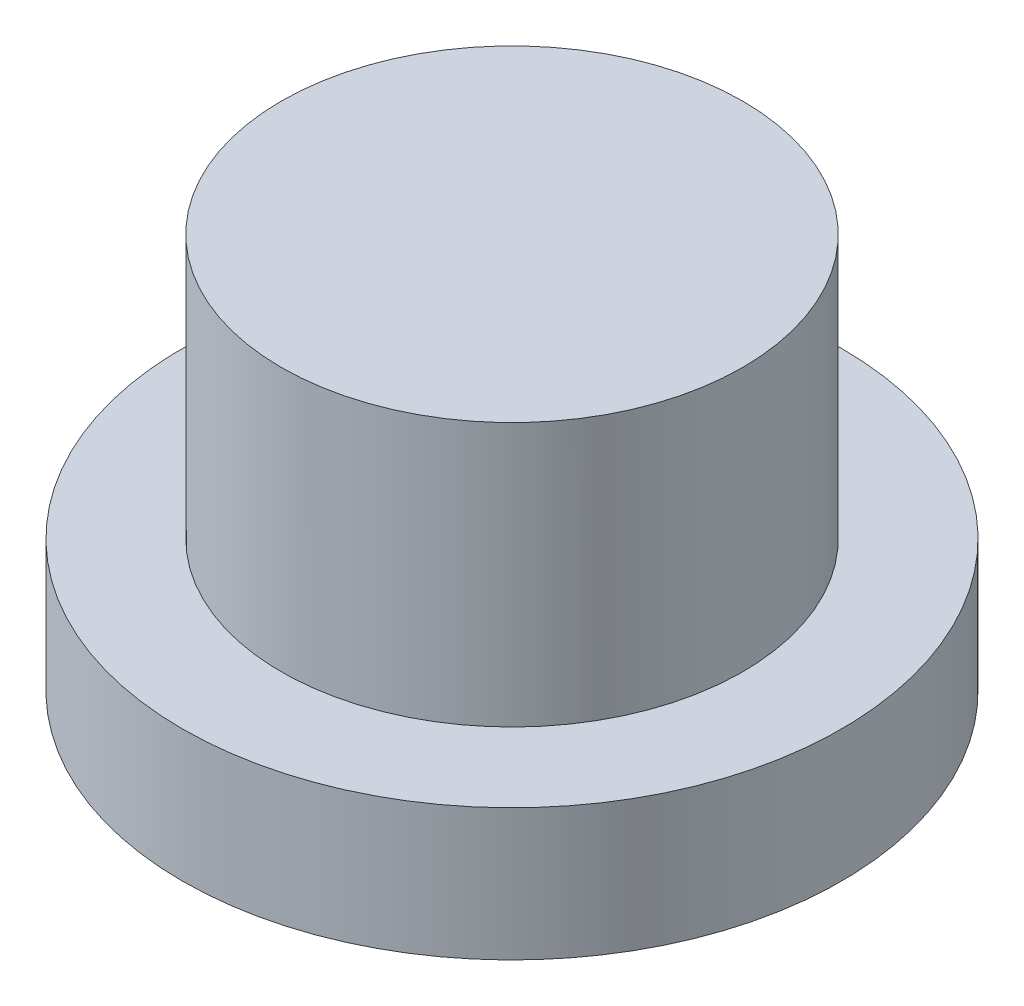
from build123d import *

# Parameters (mm, degrees)
SKETCH1_R           = 3.5
SKETCH1_R_2         = 2.55
BOSS_EXTRUDE1_DEPTH = 4
SKETCH2_R           = 3.5
BOSS_EXTRUDE2_DEPTH = 2
SKETCH4_R           = 5
SKETCH4_R_2         = 3.5
BOSS_EXTRUDE3_DEPTH = 2


with BuildPart() as part:
    # Sketch1 → Boss-Extrude1 (new body)
    with BuildSketch(Plane(origin=(0, 0, 0), x_dir=(1, 0, 0), z_dir=(0, 1, 0))):
        with Locations(Location((0, 0, 0), (0, 0, 270))):
            Circle(SKETCH1_R)
        with Locations(Location((0, 0, 0), (0, 0, 270))):
            Circle(SKETCH1_R_2, mode=Mode.SUBTRACT)
    extrude(amount=BOSS_EXTRUDE1_DEPTH)

    # Sketch2 → Boss-Extrude2 (add)
    with BuildSketch(Plane(origin=(0, 4, 0), x_dir=(1, 0, 0), z_dir=(0, 1, 0))):
        with Locations(Location((0, 0, 0), (0, 0, 270))):
            Circle(SKETCH2_R)
    extrude(amount=BOSS_EXTRUDE2_DEPTH)

    # Sketch4 → Boss-Extrude3 (add)
    with BuildSketch(Plane(origin=(0, 0, 0), x_dir=(-1, 0, 0), z_dir=(0, -1, 0))):
        with Locations(Location((0, 0, 0), (0, 0, 90))):
            Circle(SKETCH4_R)
        with Locations(Location((0, 0, 0), (0, 0, 90))):
            Circle(SKETCH4_R_2, mode=Mode.SUBTRACT)
    extrude(amount=-BOSS_EXTRUDE3_DEPTH)


solid = part.part
